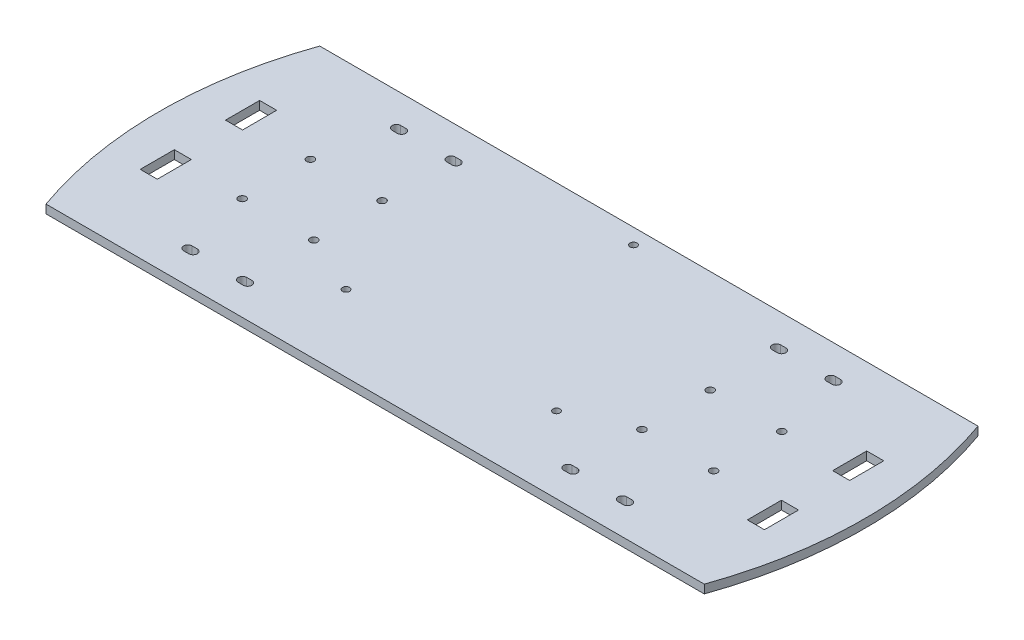
from build123d import *

# Parameters (mm, degrees)
SKETCH_1_R          = 2.05
SKETCH_1_W          = 10
SKETCH_1_H          = 20
EXTRUDE_1_DEPTH     = 5
SKETCH_4_R          = 2.2
CUT_EXTRUDE_1_DEPTH = 222.894677065


with BuildPart() as part:
    # 草圖1 → 填料-伸長1 (new body)
    with BuildSketch(Plane(origin=(0, 0, 0), x_dir=(1, 0, 0), z_dir=(0, 1, 0))):
        with BuildLine():
            Line((193, -80.25), (-193, -80.25))
            ThreePointArc((-193, -80.25), (-206.814373799, 0), (-193, 80.25))
            Line((-193, 80.25), (193, 80.25))
            ThreePointArc((193, 80.25), (206.814373799, 0), (193, -80.25))
        make_face()
        with Locations(Location((0, 71.25, 0), (0, 0, 270))):
            Circle(SKETCH_1_R, mode=Mode.SUBTRACT)
        with Locations(Location((61.70431002, -35.625, 0), (0, 0, 270))):
            Circle(SKETCH_1_R, mode=Mode.SUBTRACT)
        with Locations(Location((-61.70431002, -35.625, 0), (0, 0, 270))):
            Circle(SKETCH_1_R, mode=Mode.SUBTRACT)
        with Locations((178, -25)):
            Rectangle(SKETCH_1_W, SKETCH_1_H, mode=Mode.SUBTRACT)
        with Locations((-178, -25)):
            Rectangle(SKETCH_1_W, SKETCH_1_H, mode=Mode.SUBTRACT)
        with Locations((-178, 25)):
            Rectangle(SKETCH_1_W, SKETCH_1_H, mode=Mode.SUBTRACT)
        with Locations((178, 25)):
            Rectangle(SKETCH_1_W, SKETCH_1_H, mode=Mode.SUBTRACT)
    extrude(amount=EXTRUDE_1_DEPTH)

    # 草圖4 → 除料-伸長1 (cut, through all)
    with BuildSketch(Plane(origin=(0, 5, 0), x_dir=(1, 0, 0), z_dir=(0, 1, 0))):
        with Locations(Location((-138.2, 20, 0), (0, 0, 270))):
            Circle(SKETCH_4_R)
        with Locations(Location((-96.2, 20, 0), (0, 0, 270))):
            Circle(SKETCH_4_R)
        with Locations(Location((-96.2, -20, 0), (0, 0, 270))):
            Circle(SKETCH_4_R)
        with Locations(Location((-138.2, -20, 0), (0, 0, 270))):
            Circle(SKETCH_4_R)
        with Locations(Location((96.2, -20, 0), (0, 0, 90))):
            Circle(SKETCH_4_R)
        with Locations(Location((138.2, -20, 0), (0, 0, 90))):
            Circle(SKETCH_4_R)
        with Locations(Location((96.2, 20, 0), (0, 0, 90))):
            Circle(SKETCH_4_R)
        with Locations(Location((138.2, 20, 0), (0, 0, 90))):
            Circle(SKETCH_4_R)
        with BuildLine():
            Line((-96.9, 63.65), (-93.9, 63.65))
            ThreePointArc((-93.9, 63.65), (-91.4, 61.15), (-93.9, 58.65))
            Line((-93.9, 58.65), (-96.9, 58.65))
            ThreePointArc((-96.9, 58.65), (-99.4, 61.15), (-96.9, 63.65))
        make_face()
        with BuildLine():
            Line((-128.9, 63.65), (-125.9, 63.65))
            ThreePointArc((-125.9, 63.65), (-123.4, 61.15), (-125.9, 58.65))
            Line((-125.9, 58.65), (-128.9, 58.65))
            ThreePointArc((-128.9, 58.65), (-131.4, 61.15), (-128.9, 63.65))
        make_face()
        with BuildLine():
            Line((-96.9, -63.65), (-93.9, -63.65))
            ThreePointArc((-93.9, -63.65), (-91.4, -61.15), (-93.9, -58.65))
            Line((-93.9, -58.65), (-96.9, -58.65))
            ThreePointArc((-96.9, -58.65), (-99.4, -61.15), (-96.9, -63.65))
        make_face()
        with BuildLine():
            Line((-128.9, -63.65), (-125.9, -63.65))
            ThreePointArc((-125.9, -63.65), (-123.4, -61.15), (-125.9, -58.65))
            Line((-125.9, -58.65), (-128.9, -58.65))
            ThreePointArc((-128.9, -58.65), (-131.4, -61.15), (-128.9, -63.65))
        make_face()
        with BuildLine():
            Line((96.9, -63.65), (93.9, -63.65))
            ThreePointArc((93.9, -63.65), (91.4, -61.15), (93.9, -58.65))
            Line((93.9, -58.65), (96.9, -58.65))
            ThreePointArc((96.9, -58.65), (99.4, -61.15), (96.9, -63.65))
        make_face()
        with BuildLine():
            Line((128.9, -63.65), (125.9, -63.65))
            ThreePointArc((125.9, -63.65), (123.4, -61.15), (125.9, -58.65))
            Line((125.9, -58.65), (128.9, -58.65))
            ThreePointArc((128.9, -58.65), (131.4, -61.15), (128.9, -63.65))
        make_face()
        with BuildLine():
            Line((96.9, 63.65), (93.9, 63.65))
            ThreePointArc((93.9, 63.65), (91.4, 61.15), (93.9, 58.65))
            Line((93.9, 58.65), (96.9, 58.65))
            ThreePointArc((96.9, 58.65), (99.4, 61.15), (96.9, 63.65))
        make_face()
        with BuildLine():
            Line((128.9, 63.65), (125.9, 63.65))
            ThreePointArc((125.9, 63.65), (123.4, 61.15), (125.9, 58.65))
            Line((125.9, 58.65), (128.9, 58.65))
            ThreePointArc((128.9, 58.65), (131.4, 61.15), (128.9, 63.65))
        make_face()
    extrude(amount=-CUT_EXTRUDE_1_DEPTH, mode=Mode.SUBTRACT)


solid = part.part
